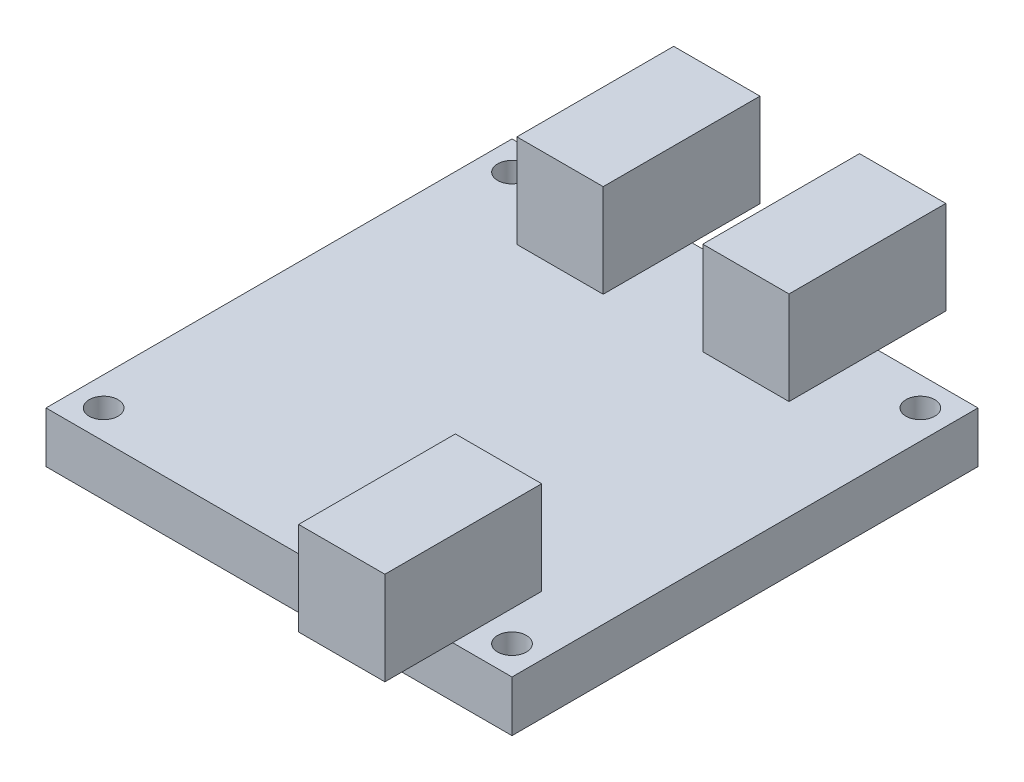
from build123d import *

# Parameters (mm, degrees)
SKETCH1_W            = 54.99
SKETCH1_H            = 54.99
BOSS_EXTRUDE1_DEPTH  = 6
M3_CLEARANCE_HOLE2_D = 3.4
SKETCH8_W            = 10.18
SKETCH8_H            = 18.5
BOSS_EXTRUDE2_DEPTH  = 11


with BuildPart() as part:
    # Sketch1 → Boss-Extrude1 (new body)
    with BuildSketch(Plane(origin=(0, 0, 0), x_dir=(1, 0, 0), z_dir=(0, 1, 0))):
        Rectangle(SKETCH1_W, SKETCH1_H)
    extrude(amount=BOSS_EXTRUDE1_DEPTH)

    # M3 Clearance Hole2 (through all)
    with Locations(Plane(origin=(0, 6, 0), x_dir=(1, 0, 0), z_dir=(0, 1, 0))):
        with Locations((-24.095, 24.095), (24.095, 24.095), (24.095, -24.095), (-24.095, -24.095)):
            Hole(M3_CLEARANCE_HOLE2_D / 2)

    # Sketch8 → Boss-Extrude2 (add)
    with BuildSketch(Plane(origin=(0, 6, 0), x_dir=(1, 0, 0), z_dir=(0, 1, 0))):
        with Locations((-11.325, 26.245)):
            Rectangle(SKETCH8_W, SKETCH8_H)
        with Locations((10.605, 26.245)):
            Rectangle(SKETCH8_W, SKETCH8_H)
        with Locations((15.405, -26.245)):
            Rectangle(SKETCH8_W, SKETCH8_H)
    extrude(amount=BOSS_EXTRUDE2_DEPTH)


solid = part.part
